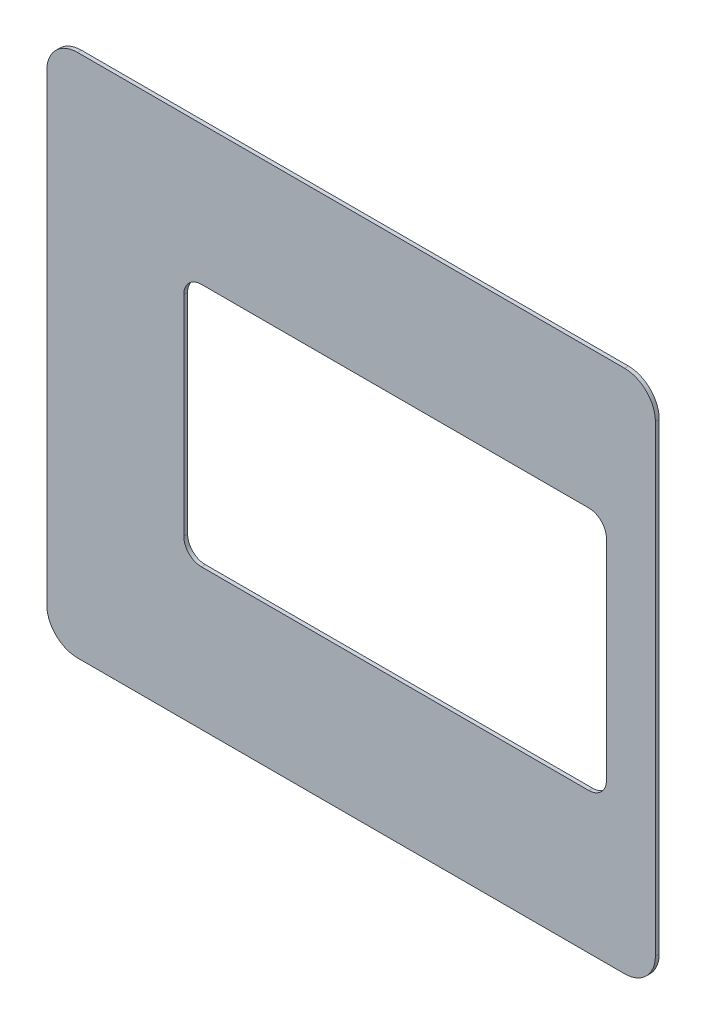
from build123d import *

# Parameters (mm, degrees)
SKETCH1_W           = 79
SKETCH1_H           = 68.072
BOSS_EXTRUDE1_DEPTH = 0.5
FILLET1_R           = 4
CUT_EXTRUDE1_DEPTH  = 53.143545104


with BuildPart() as part:
    # Sketch1 → Boss-Extrude1 (new body)
    with BuildSketch(Plane.XY):
        Rectangle(SKETCH1_W, SKETCH1_H)
    extrude(amount=BOSS_EXTRUDE1_DEPTH)

    # Fillet1
    fillet1_edges = [part.edges().sort_by_distance(p)[0] for p in [
        (-39.5, 34.036, 0.25),
        (39.5, 34.036, 0.25),
        (39.5, -34.036, 0.25),
        (-39.5, -34.036, 0.25),
    ]]
    fillet(fillet1_edges, radius=FILLET1_R)

    # Sketch2 → Cut-Extrude1 (cut, through all)
    with BuildSketch(Plane.XY.offset(0.5)):
        with BuildLine():
            Line((-19.428, 16.002), (30.864, 16.002))
            ThreePointArc((30.864, 16.002), (32.480446102, 15.332446102), (33.15, 13.716))
            Line((33.15, 13.716), (33.15, -13.462))
            ThreePointArc((33.15, -13.462), (32.480446102, -15.078446102), (30.864, -15.748))
            Line((30.864, -15.748), (-19.428, -15.748))
            ThreePointArc((-19.428, -15.748), (-21.044446102, -15.078446102), (-21.714, -13.462))
            Line((-21.714, -13.462), (-21.714, 13.716))
            ThreePointArc((-21.714, 13.716), (-21.044446102, 15.332446102), (-19.428, 16.002))
        make_face()
    extrude(amount=-CUT_EXTRUDE1_DEPTH, mode=Mode.SUBTRACT)


solid = part.part
